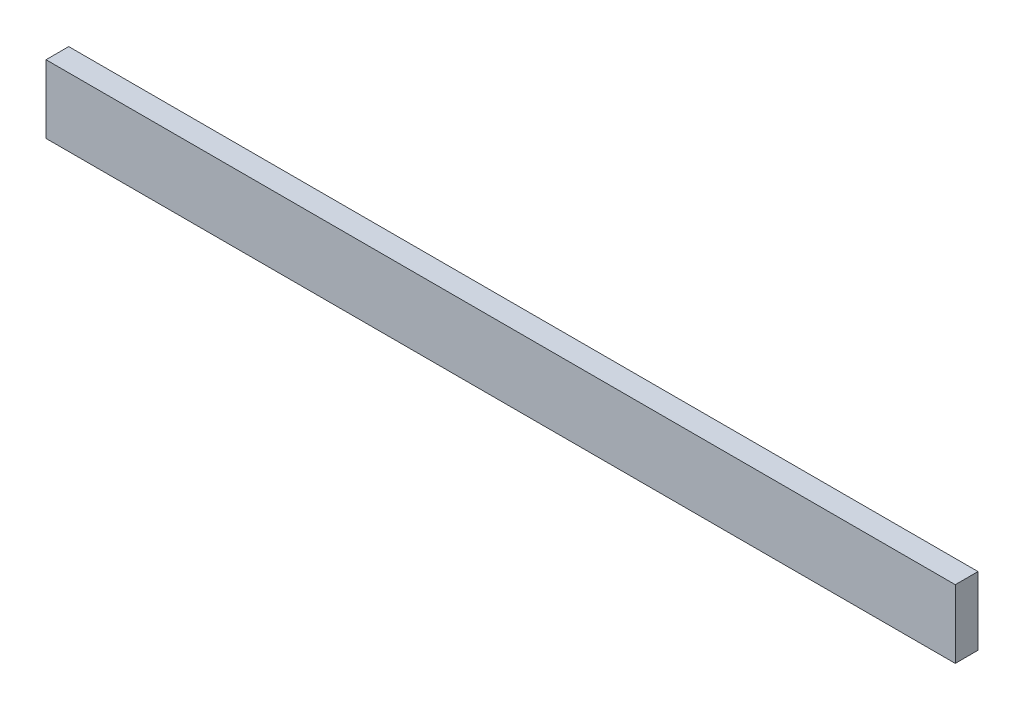
from build123d import *

# Parameters (mm, degrees)
SKETCH1_W           = 25.4
SKETCH1_H           = 76.2
BOSS_EXTRUDE1_DEPTH = 508


with BuildPart() as part:
    # Sketch1 → Boss-Extrude1 (new, symmetric)
    with BuildSketch(Plane(origin=(0, 0, 0), x_dir=(0, 0, -1), z_dir=(1, 0, 0))):
        Rectangle(SKETCH1_W, SKETCH1_H)
    extrude(amount=BOSS_EXTRUDE1_DEPTH, both=True)


solid = part.part
